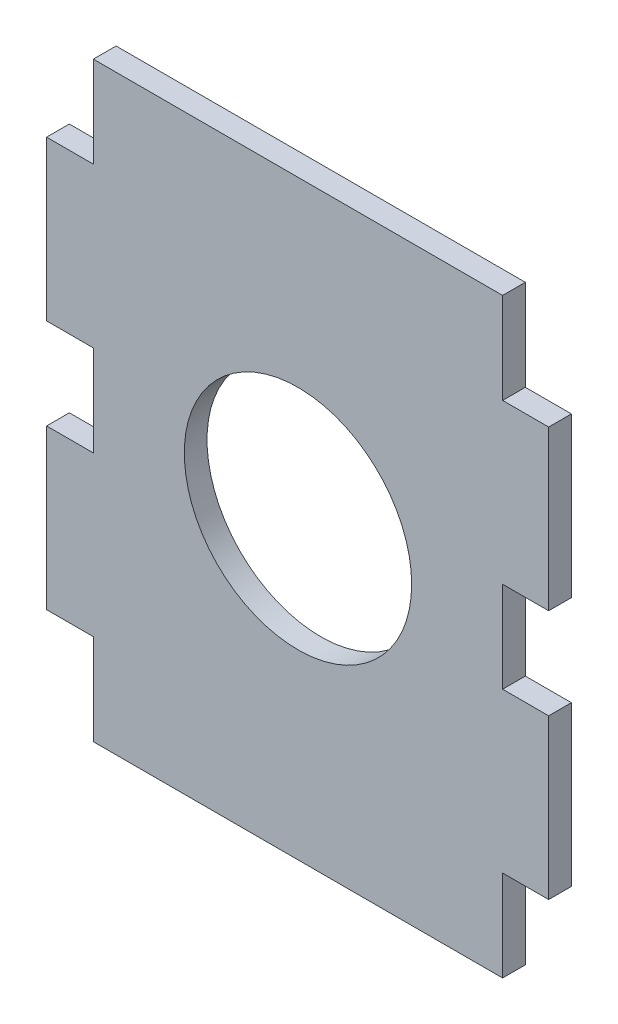
from build123d import *

# Parameters (mm, degrees)
SKETCH1_R           = 15.875
BOSS_EXTRUDE1_DEPTH = 3.175


with BuildPart() as part:
    # Sketch1 → Boss-Extrude1 (new body)
    with BuildSketch(Plane.XY):
        Polygon((-56.673769495, 356.078918744), (0.476230503, 356.078918744), (0.476230503, 343.378918744), (6.908503105, 343.378918744), (6.908503105, 321.153918744), (0.476230503, 321.153918744), (0.476230503, 308.453918744), (6.908503105, 308.453918744), (6.908503105, 286.228918744), (0.476230503, 286.228918744), (0.476230503, 273.528918744), (-56.673769495, 273.528918744), (-56.673769495, 286.228918744), (-63.203160658, 286.228918744), (-63.203160658, 308.453918744), (-56.673769495, 308.453918744), (-56.673769495, 321.153918744), (-63.203160658, 321.153918744), (-63.203160658, 343.378918744), (-56.673769495, 343.378918744), align=None)
        with Locations((-28.098769497, 314.803918744)):
            Circle(SKETCH1_R, mode=Mode.SUBTRACT)
    extrude(amount=-BOSS_EXTRUDE1_DEPTH)


solid = part.part
